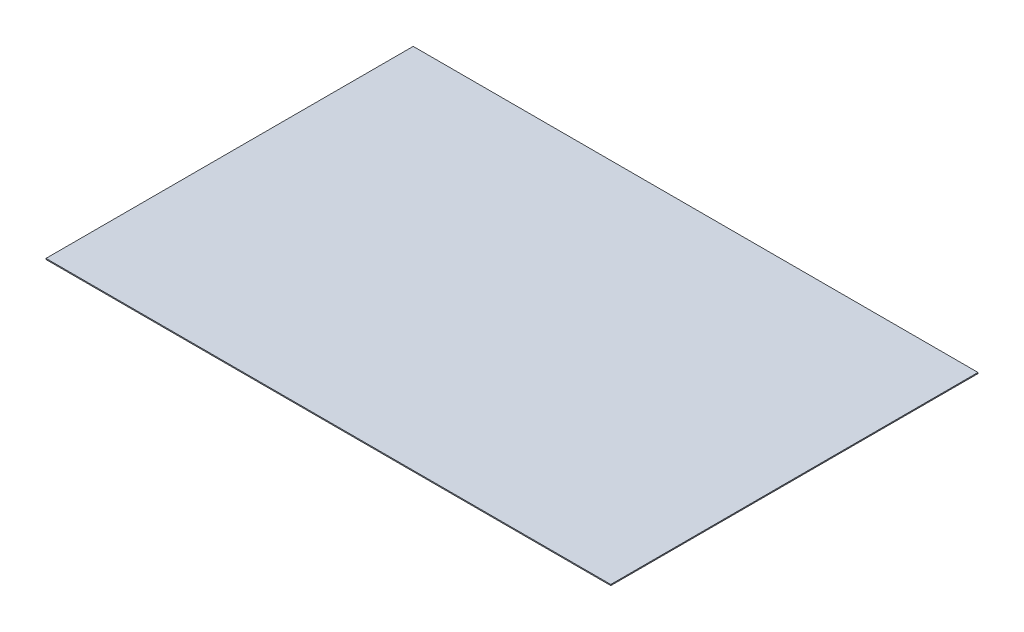
from build123d import *

# Parameters (mm, degrees)
SKETCH1_W           = 1089
SKETCH1_H           = 708
BOSS_EXTRUDE1_DEPTH = 2


with BuildPart() as part:
    # Sketch1 → Boss-Extrude1 (new body)
    with BuildSketch(Plane(origin=(0, 0, 0), x_dir=(1, 0, 0), z_dir=(0, 1, 0))):
        with Locations((-75.810111812, 149.266095426)):
            Rectangle(SKETCH1_W, SKETCH1_H)
    extrude(amount=BOSS_EXTRUDE1_DEPTH)


solid = part.part
